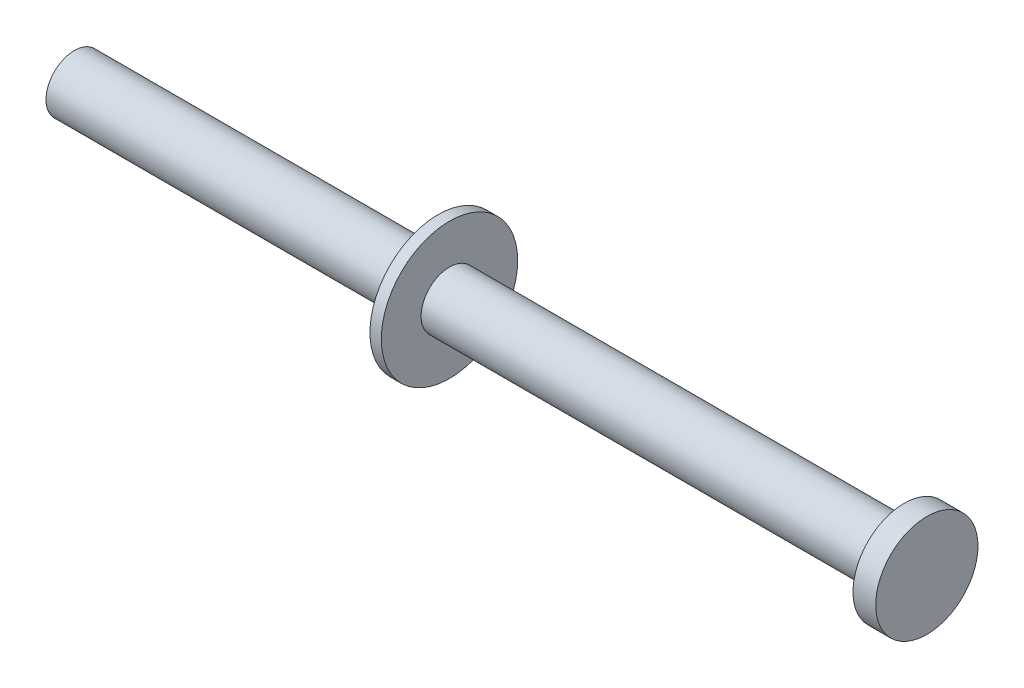
from build123d import *

# Parameters (mm, degrees)
SKETCH2_R           = 9
BOSS_EXTRUDE1_DEPTH = 4
SKETCH3_R           = 5
BOSS_EXTRUDE2_DEPTH = 146
SKETCH4_R           = 12
BOSS_EXTRUDE3_DEPTH = 2


with BuildPart() as part:
    # Sketch2 → Boss-Extrude1 (new body)
    with BuildSketch(Plane(origin=(0, 0, 0), x_dir=(0, 0, -1), z_dir=(1, 0, 0))):
        Circle(SKETCH2_R)
    extrude(amount=BOSS_EXTRUDE1_DEPTH)

    # Sketch3 → Boss-Extrude2 (add)
    with BuildSketch(Plane.ZY):
        Circle(SKETCH3_R)
    extrude(amount=BOSS_EXTRUDE2_DEPTH)

    # Sketch4 → Boss-Extrude3 (add)
    with BuildSketch(Plane(origin=(-80, 0, 0), x_dir=(0, 0, -1), z_dir=(1, 0, 0))):
        Circle(SKETCH4_R)
    extrude(amount=-BOSS_EXTRUDE3_DEPTH)


solid = part.part
